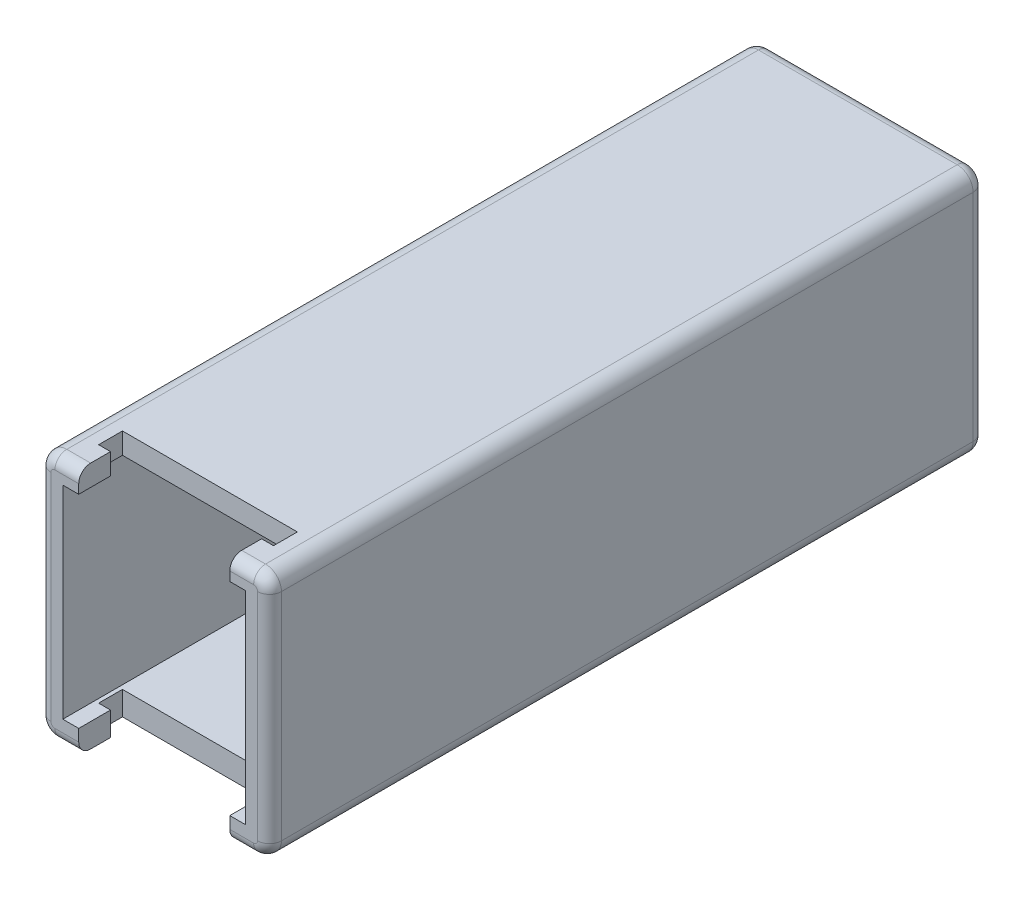
from build123d import *

# Parameters (mm, degrees)
SKETCH_1_W               = 29
SKETCH_1_H               = 31.151212228
SKETCH_1_W_2             = 23
SKETCH_1_H_2             = 25.5
EXTRUDE_1_DEPTH          = 90
SKETCH_1_2_W             = 23
SKETCH_1_2_H             = 25.5
EXTRUDE_2_DEPTH          = 2
SKETCH_2_W               = 8
SKETCH_2_H               = 3
CUT_EXTRUDE_1_DEPTH      = 10
CUT_EXTRUDE_2_DEPTH      = 93.511147977
CUT_EXTRUDE_2_DEPTH_BACK = 93.511147977
FILLET_1_R               = 2
FILLET_2_R               = 1.5


with BuildPart() as part:
    # 스케치1 → 보스-돌출1 (new body)
    with BuildSketch(Plane.XY):
        with Locations((0, -0.174393886)):
            Rectangle(SKETCH_1_W, SKETCH_1_H)
        Rectangle(SKETCH_1_W_2, SKETCH_1_H_2, mode=Mode.SUBTRACT)
    extrude(amount=EXTRUDE_1_DEPTH)

    # 스케치1<2> → 보스-돌출2 (add)
    with BuildSketch(Plane.XY):
        Rectangle(SKETCH_1_2_W, SKETCH_1_2_H)
    extrude(amount=EXTRUDE_2_DEPTH)

    # 스케치2 → 컷-돌출1 (cut)
    with BuildSketch(Plane(origin=(0, 0, 0), x_dir=(-1, 0, 0), z_dir=(0, 0, -1))):
        with Locations((0, -14.25)):
            Rectangle(SKETCH_2_W, SKETCH_2_H)
    extrude(amount=-CUT_EXTRUDE_1_DEPTH, mode=Mode.SUBTRACT)

    # 스케치3 → 컷-돌출2 (cut, two sides: drawn at the far end of the back side and taken through both)
    with BuildSketch(Plane(origin=(0, 0, 0), x_dir=(1, 0, 0), z_dir=(0, 1, 0)).offset(-CUT_EXTRUDE_2_DEPTH_BACK)):
        Polygon((-9.5, -90), (-9.5, -86), (-11, -86), (-11, -83), (11, -83), (11, -86), (9.5, -86), (9.5, -90), align=None)
    extrude(amount=CUT_EXTRUDE_2_DEPTH + CUT_EXTRUDE_2_DEPTH_BACK, mode=Mode.SUBTRACT)

    # 필렛1
    fillet_1_edges = [part.edges().sort_by_distance(p)[0] for p in [
        (-14.5, -15.75, 45),
        (14.5, -15.75, 45),
        (14.5, 15.401212228, 45),
        (-14.5, 15.401212228, 45),
    ]]
    fillet(fillet_1_edges, radius=FILLET_1_R)

    # 필렛2
    fillet_2_edges = [part.edges().sort_by_distance(p)[0] for p in [
        (11, -15.75, 90),
        (13.914213562, -15.164213562, 90),
        (11, 15.401212228, 90),
        (13.914213562, 14.81542579, 90),
        (-11, 15.401212228, 90),
        (-13.914213562, 14.81542579, 90),
        (-11, -15.75, 90),
        (-13.914213562, -15.164213562, 90),
        (8.25, -15.75, 0),
        (13.914213562, -15.164213562, 0),
        (14.5, -0.174393886, 0),
        (13.914213562, 14.81542579, 0),
        (-8.25, -15.75, 0),
        (-13.914213562, -15.164213562, 0),
        (-14.5, -0.174393886, 0),
        (-13.914213562, 14.81542579, 0),
        (14.5, -0.174393886, 90),
        (-14.5, -0.174393886, 90),
        (0, 15.401212228, 0),
    ]]
    fillet(fillet_2_edges, radius=FILLET_2_R)


solid = part.part
